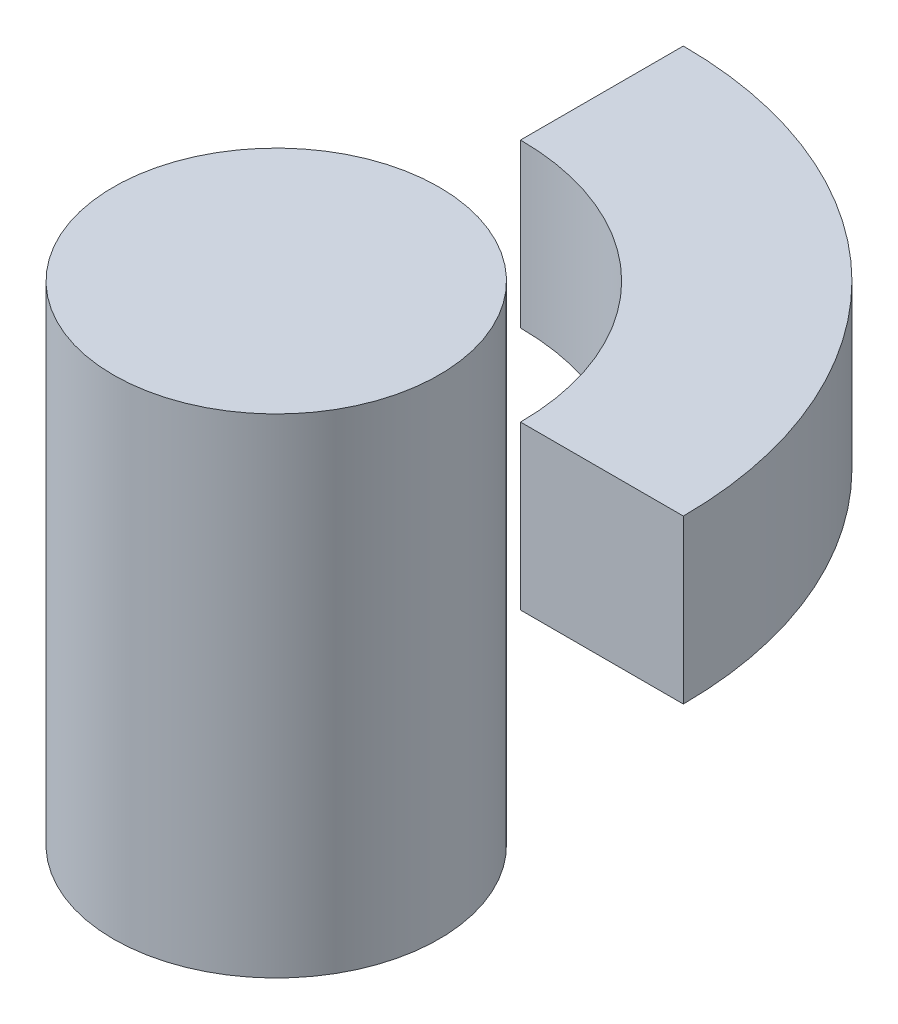
from build123d import *

# Parameters (mm, degrees)
BOSS_EXTRUDE1_DEPTH      = 15
BOSS_EXTRUDE1_DEPTH_BACK = 15
SKETCH1_R                = 10
SKETCH2_W                = 10
SKETCH2_H                = 10
REVOLVE1_ANGLE           = 90


with BuildPart() as part:
    # Sketch1 → Boss-Extrude1 (new, two sides: drawn at the far end of the back side and taken through both)
    with BuildSketch(Plane(origin=(0, 0, 0), x_dir=(1, 0, 0), z_dir=(0, 1, 0)).offset(-BOSS_EXTRUDE1_DEPTH_BACK)):
        with Locations((20, 0)):
            Circle(SKETCH1_R)
    extrude(amount=BOSS_EXTRUDE1_DEPTH + BOSS_EXTRUDE1_DEPTH_BACK)


with BuildPart() as body_2:
    # Sketch2 → Revolve1 (revolve)
    with BuildSketch(Plane.XY):
        with Locations((40, 10)):
            Rectangle(SKETCH2_W, SKETCH2_H)
    revolve(axis=Axis((20, -15, 0), (0, 1, 0)), revolution_arc=REVOLVE1_ANGLE)


solid = Compound([part.part, body_2.part])
